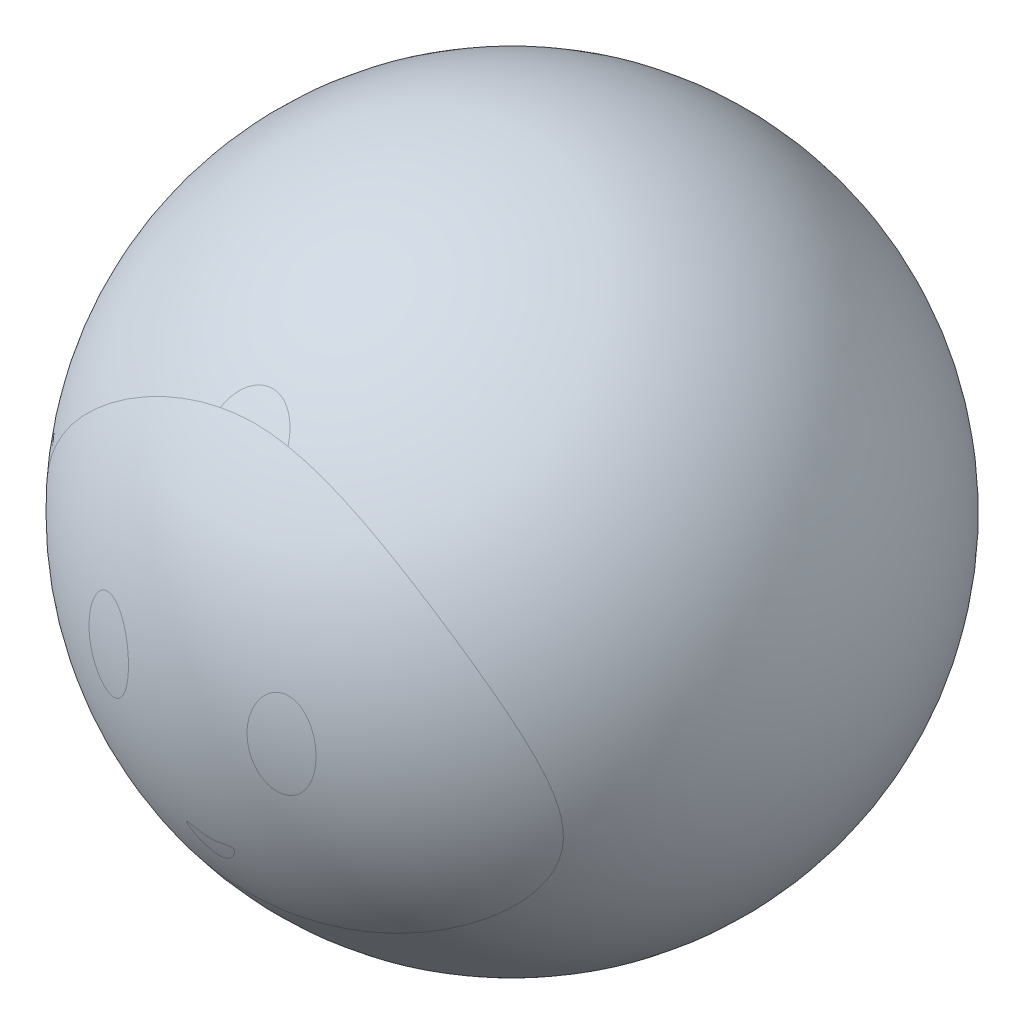
from build123d import *

# Parameters (mm, degrees)
SKETCH9_R           = 2.5
BOSS_EXTRUDE2_DEPTH = 37


with BuildPart() as part:
    # Sketch1 → Revolve1 (revolve)
    with BuildSketch(Plane(origin=(0, 0, 0), x_dir=(0, 0, -1), z_dir=(1, 0, 0))):
        with BuildLine():
            Line((0, 35), (0, -35))
            ThreePointArc((0, -35), (-35, 0), (0, 35))
        make_face()
    revolve(axis=Axis((0, 43.799528719, 0), (0, -1, 0)))

    # Sketch9 → Boss-Extrude2 (add)
    with BuildSketch(Plane(origin=(0, 0, 0), x_dir=(1, 0, 0), z_dir=(0, 1, 0))):
        with Locations(Location((0, 0, 0), (0, 0, 270))):
            Circle(SKETCH9_R)
    extrude(amount=-BOSS_EXTRUDE2_DEPTH)


solid = part.part
